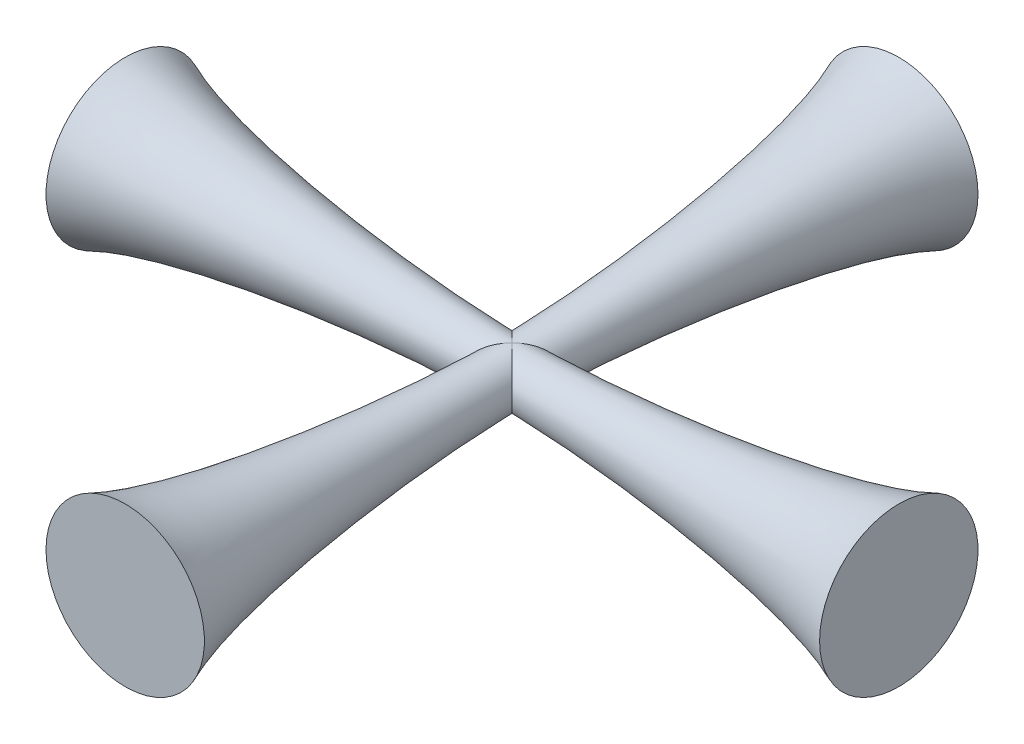
from build123d import *

# Parameters (mm, degrees)
PATTERN_CIRCULAR_3_COUNT = 4


with BuildPart() as part:
    # 草图1 → 旋转1 (revolve)
    with BuildSketch(Plane(origin=(0, 0, 0), x_dir=(1, 0, 0), z_dir=(0, 1, 0))):
        with BuildLine():
            Line((0, 0), (0, -36.748051116))
            Line((0, -36.748051116), (-7.524654351, -36.748051116))
            add(Edge.make_bspline(
                [(-2.395571036, 0), (-2.395571036, -10.269932721), (-4.281645701, -29.256357428), (-7.524654351, -36.748051116)],
                knots=[0, 0, 0, 0, 1, 1, 1, 1], degree=3))
            Line((-2.395571036, 0), (0, 0))
        make_face()
    revolve_1 = revolve(axis=Axis((0, 0, 0), (0, 0, 1)))

    # 阵列(圆周)3: 旋转1 ×4 about axis
    pattern_circular_3_axis = Axis((0, 5.442530379, 0), (0, -1, 0))
    for i in range(1, PATTERN_CIRCULAR_3_COUNT):
        add(revolve_1.rotate(pattern_circular_3_axis, i * 360 / PATTERN_CIRCULAR_3_COUNT))


solid = part.part
